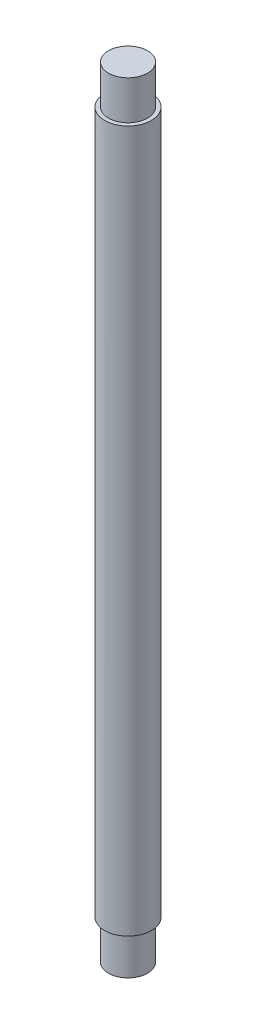
from build123d import *

# Parameters (mm, degrees)
SKETCH1_R           = 3
BOSS_EXTRUDE1_DEPTH = 100
SKETCH2_R           = 3.804683346
SKETCH2_R_2         = 2.5
CUT_EXTRUDE1_DEPTH  = 5
CUT_EXTRUDE2_START  = -5
SKETCH3_R           = 4.634260774
SKETCH3_R_2         = 2.5
CUT_EXTRUDE2_DEPTH  = 5


with BuildPart() as part:
    # Sketch1 → Boss-Extrude1 (new body)
    with BuildSketch(Plane(origin=(0, 0, 0), x_dir=(1, 0, 0), z_dir=(0, 1, 0))):
        with Locations(Location((0, 0, 0), (0, 0, 270))):
            Circle(SKETCH1_R)
    extrude(amount=BOSS_EXTRUDE1_DEPTH)

    # Sketch2 → Cut-Extrude1 (cut)
    with BuildSketch(Plane.XZ):
        Circle(SKETCH2_R)
        with Locations(Location((0, 0, 0), (0, 0, 270))):
            Circle(SKETCH2_R_2, mode=Mode.SUBTRACT)
    extrude(amount=-CUT_EXTRUDE1_DEPTH, mode=Mode.SUBTRACT)

    # Sketch3 → Cut-Extrude2 (cut)
    with BuildSketch(Plane(origin=(0, 100, 0), x_dir=(1, 0, 0), z_dir=(0, 1, 0)).offset(CUT_EXTRUDE2_START)):
        Circle(SKETCH3_R)
        with Locations(Location((0, 0, 0), (0, 0, 90))):
            Circle(SKETCH3_R_2, mode=Mode.SUBTRACT)
    extrude(amount=CUT_EXTRUDE2_DEPTH, mode=Mode.SUBTRACT)


solid = part.part
